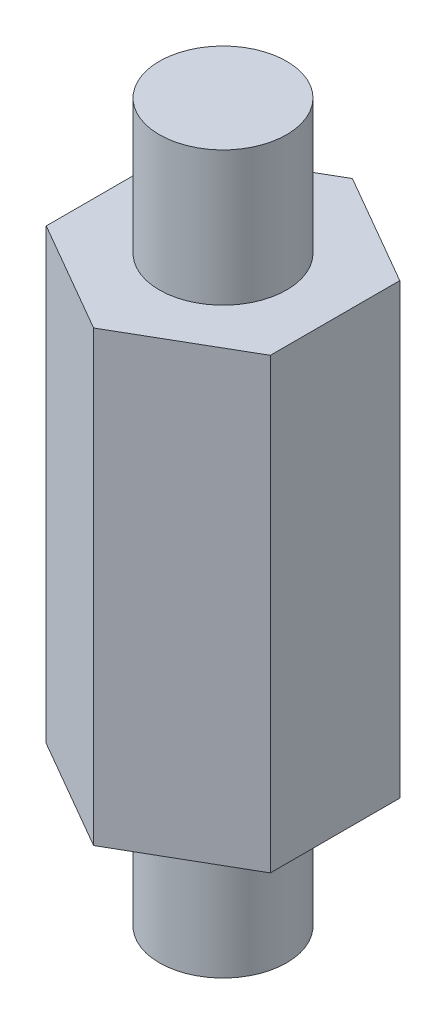
from build123d import *

# Parameters (mm, degrees)
BOSS_EXTRUDE1_DEPTH = 10
SKETCH2_R           = 1.42
BOSS_EXTRUDE2_DEPTH = 3
BOSS_EXTRUDE3_START = 3
SKETCH3_R           = 1.42
BOSS_EXTRUDE3_DEPTH = 3


with BuildPart() as part:
    # Sketch1 → Boss-Extrude1 (new body)
    with BuildSketch(Plane(origin=(0, 0, 0), x_dir=(1, 0, 0), z_dir=(0, 1, 0))):
        Polygon((0, 2.886751346), (-2.5, 1.443375673), (-2.5, -1.443375673), (0, -2.886751346), (2.5, -1.443375673), (2.5, 1.443375673), align=None)
    extrude(amount=BOSS_EXTRUDE1_DEPTH)

    # Sketch2 → Boss-Extrude2 (add)
    with BuildSketch(Plane(origin=(0, 10, 0), x_dir=(1, 0, 0), z_dir=(0, 1, 0))):
        with Locations(Location((0, 0, 0), (0, 0, 270))):
            Circle(SKETCH2_R)
    extrude(amount=BOSS_EXTRUDE2_DEPTH)

    # Sketch3 → Boss-Extrude3 (add)
    with BuildSketch(Plane(origin=(0, 0, 0), x_dir=(-1, 0, 0), z_dir=(0, -1, 0)).offset(BOSS_EXTRUDE3_START)):
        with Locations(Location((0, 0, 0), (0, 0, 270))):
            Circle(SKETCH3_R)
    extrude(amount=-BOSS_EXTRUDE3_DEPTH)


solid = part.part
